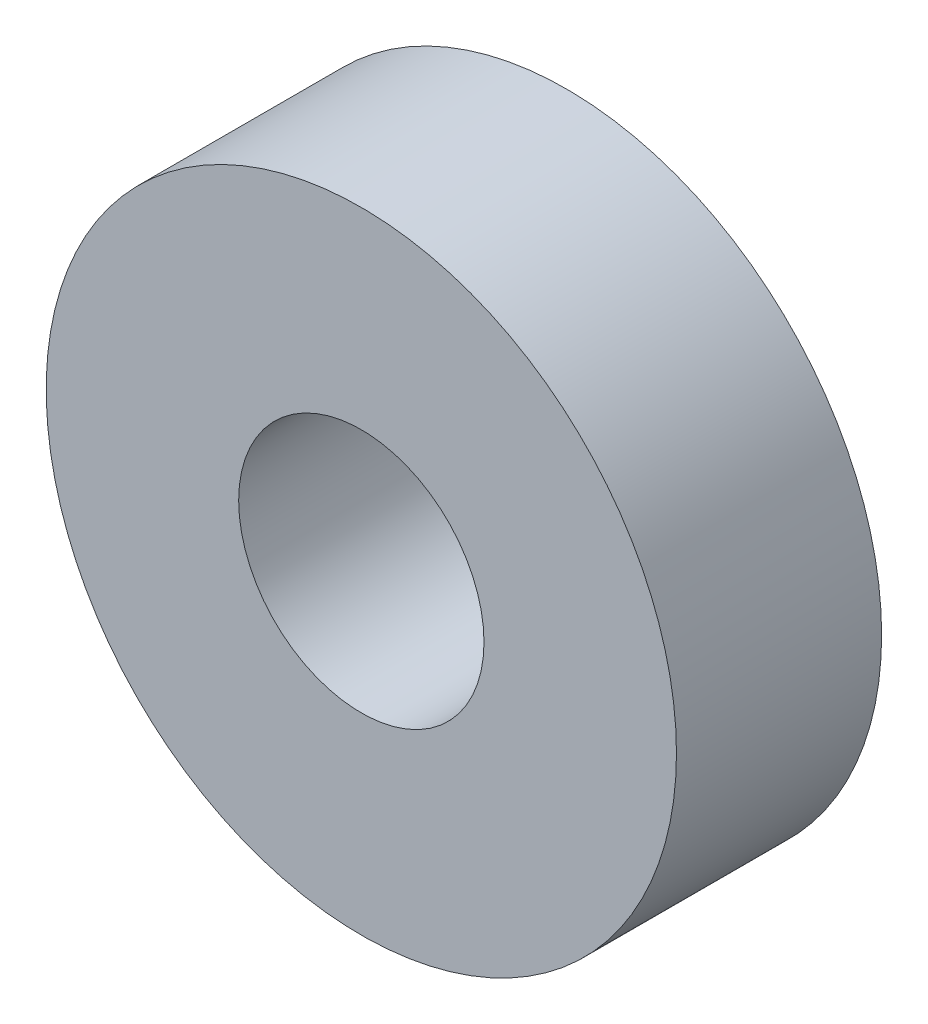
from build123d import *

# Parameters (mm, degrees)
ESBO_O1_R                = 7.45
ESBO_O1_R_2              = 2.9
RESSALTO_EXTRUS_O1_DEPTH = 4.85


with BuildPart() as part:
    # Esboço1 → Ressalto-extrusão1 (new body)
    with BuildSketch(Plane.XY):
        Circle(ESBO_O1_R)
        Circle(ESBO_O1_R_2, mode=Mode.SUBTRACT)
    extrude(amount=RESSALTO_EXTRUS_O1_DEPTH)


solid = part.part
